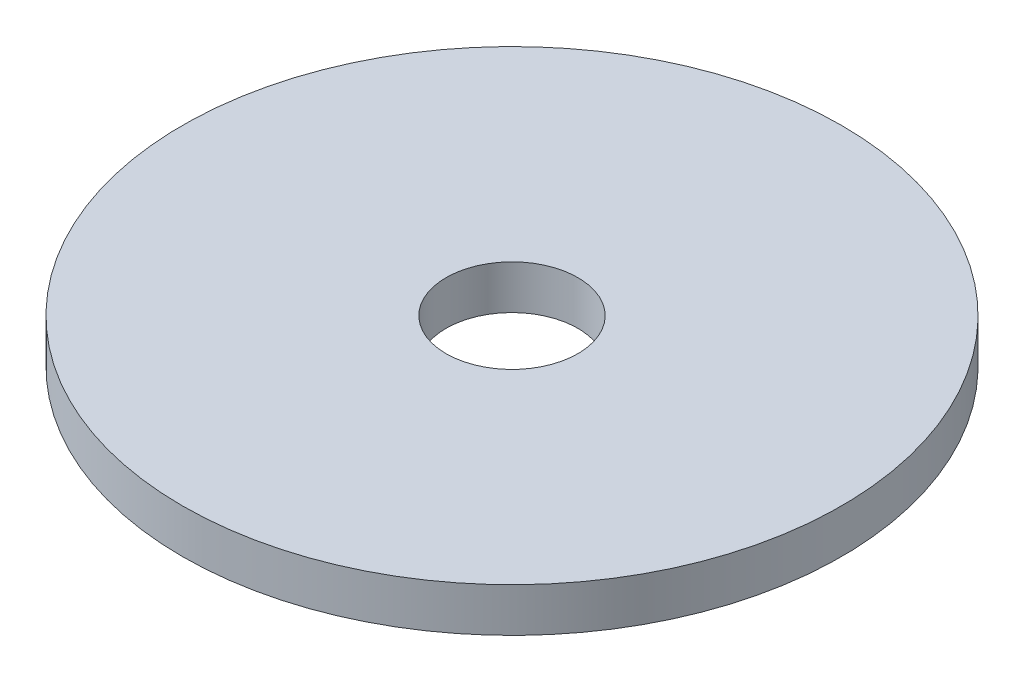
from build123d import *

# Parameters (mm, degrees)
SKETCH_1_R      = 15
SKETCH_1_R_2    = 3
EXTRUDE_1_DEPTH = 2


with BuildPart() as part:
    # 草图1 → 凸台-拉伸1 (new body)
    with BuildSketch(Plane(origin=(0, 0, 0), x_dir=(1, 0, 0), z_dir=(0, 1, 0))):
        with Locations(Location((0, 0, 0), (0, 0, 270))):
            Circle(SKETCH_1_R)
        with Locations(Location((0, 0, 0), (0, 0, 270))):
            Circle(SKETCH_1_R_2, mode=Mode.SUBTRACT)
    extrude(amount=EXTRUDE_1_DEPTH)


solid = part.part
